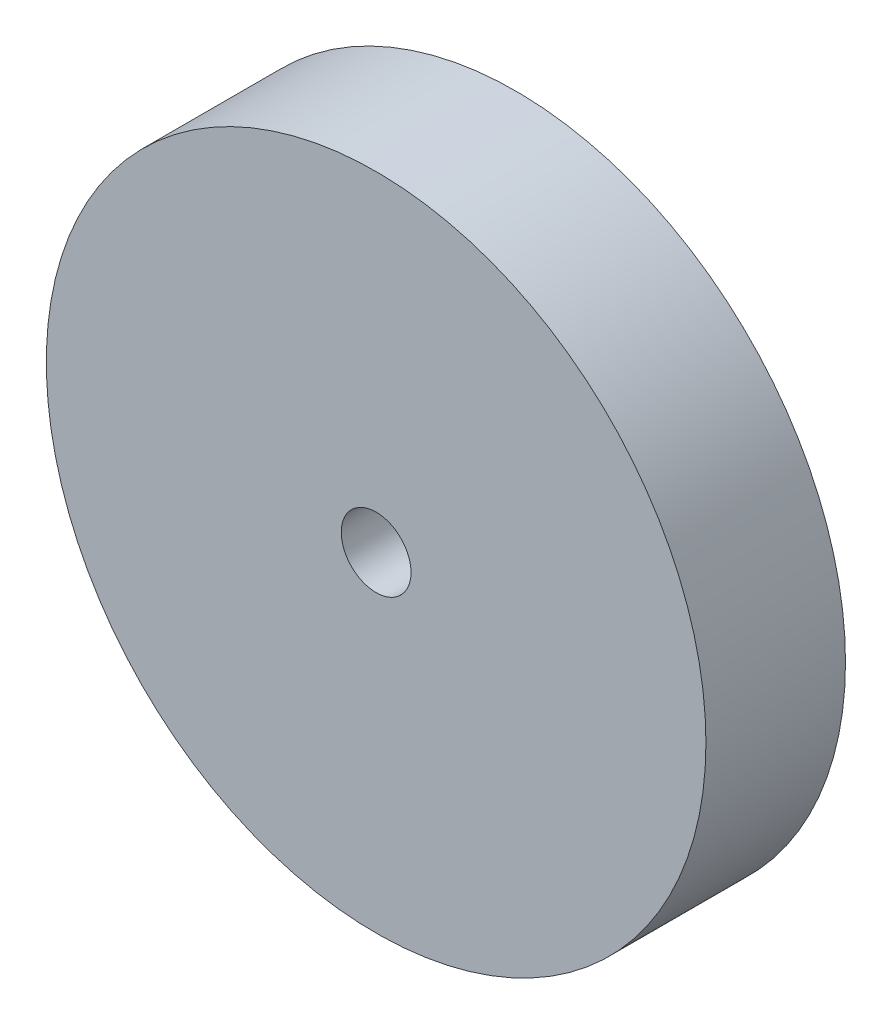
from build123d import *

# Parameters (mm, degrees)
SKETCH1_R           = 9.45299319
BOSS_EXTRUDE1_DEPTH = 4
SKETCH2_R           = 1
CUT_EXTRUDE1_DEPTH  = 14.954144922


with BuildPart() as part:
    # Sketch1 → Boss-Extrude1 (new body)
    with BuildSketch(Plane.XY):
        Circle(SKETCH1_R)
    extrude(amount=BOSS_EXTRUDE1_DEPTH)

    # Sketch2 → Cut-Extrude1 (cut, through all)
    with BuildSketch(Plane.XY.offset(4)):
        Circle(SKETCH2_R)
    extrude(amount=-CUT_EXTRUDE1_DEPTH, mode=Mode.SUBTRACT)


solid = part.part
